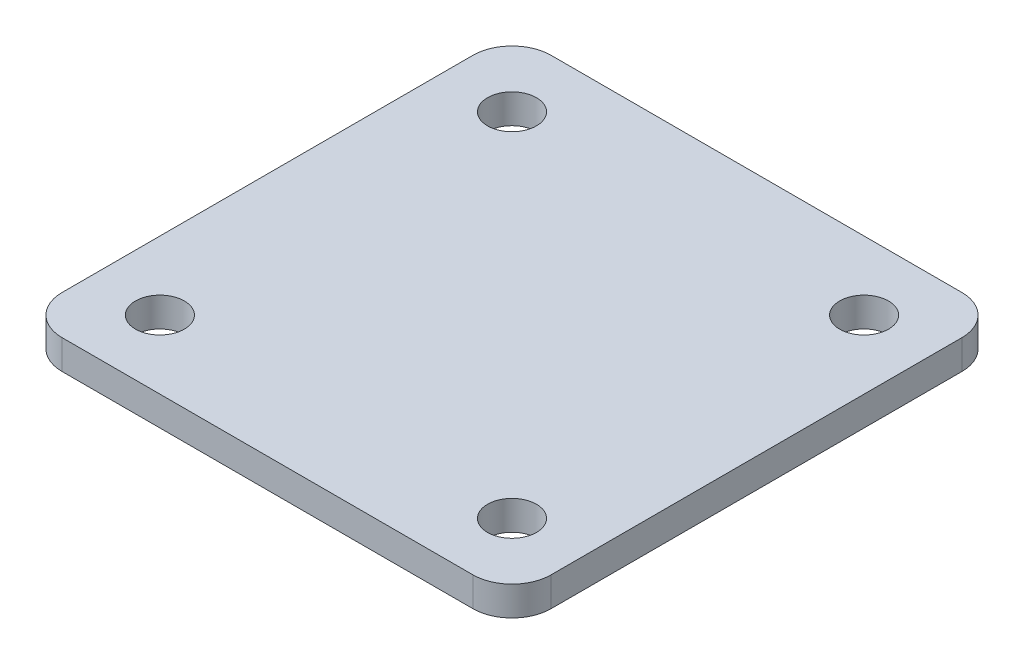
from build123d import *

# Parameters (mm, degrees)
SKETCH1_W           = 50
SKETCH1_H           = 50
BOSS_EXTRUDE1_DEPTH = 3
FILLET1_R           = 4
SKETCH2_R           = 2.5
CUT_EXTRUDE1_DEPTH  = 3


with BuildPart() as part:
    # Sketch1 → Boss-Extrude1 (new body)
    with BuildSketch(Plane(origin=(0, 0, 0), x_dir=(1, 0, 0), z_dir=(0, 1, 0))):
        Rectangle(SKETCH1_W, SKETCH1_H)
    extrude(amount=BOSS_EXTRUDE1_DEPTH)

    # Fillet1
    fillet1_edges = [part.edges().sort_by_distance(p)[0] for p in [
        (25, 1.5, 25),
        (-25, 1.5, 25),
        (-25, 1.5, -25),
        (25, 1.5, -25),
    ]]
    fillet(fillet1_edges, radius=FILLET1_R)

    # Sketch2 → Cut-Extrude1 (cut)
    with BuildSketch(Plane(origin=(0, 3, 0), x_dir=(1, 0, 0), z_dir=(0, 1, 0))):
        with Locations(Location((-18, 18, 0), (0, 0, 270))):
            Circle(SKETCH2_R)
        with Locations(Location((18, 18, 0), (0, 0, 270))):
            Circle(SKETCH2_R)
        with Locations(Location((18, -18, 0), (0, 0, 270))):
            Circle(SKETCH2_R)
        with Locations(Location((-18, -18, 0), (0, 0, 270))):
            Circle(SKETCH2_R)
    extrude(amount=-CUT_EXTRUDE1_DEPTH, mode=Mode.SUBTRACT)


solid = part.part
